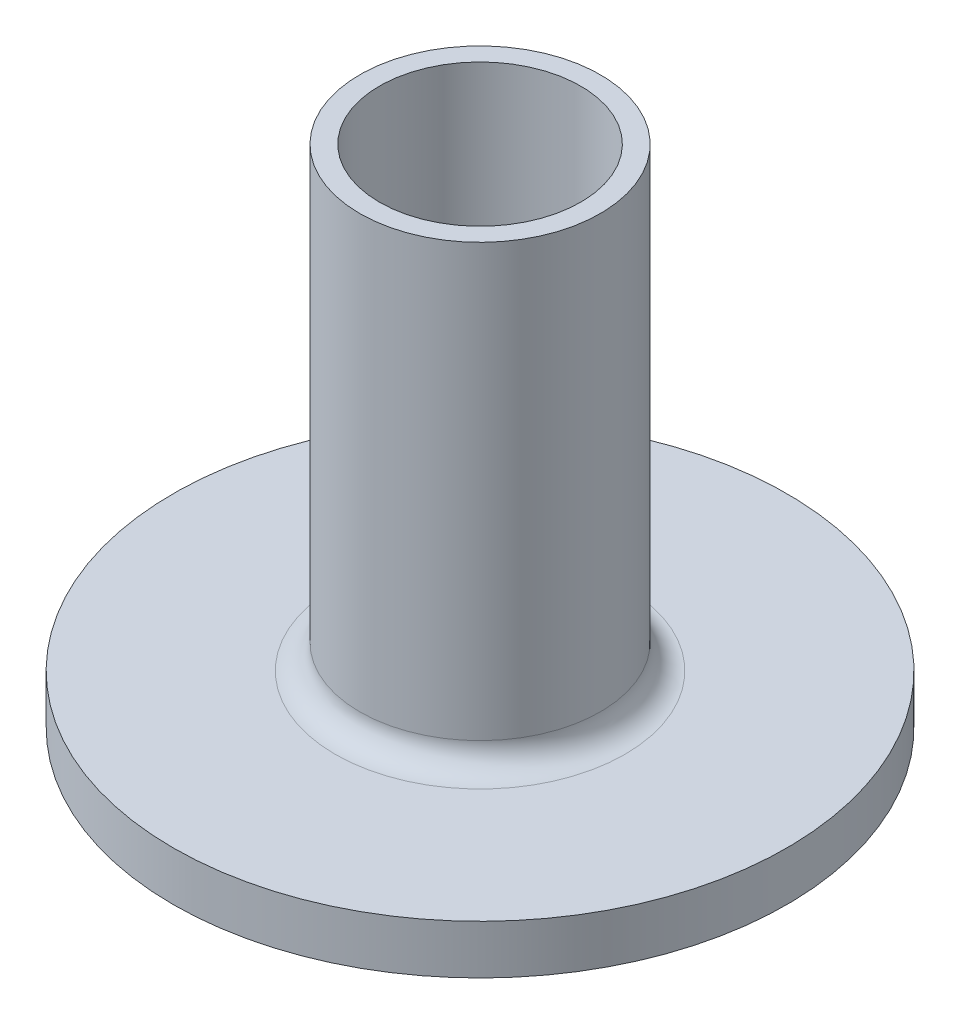
from build123d import *

# Parameters (mm, degrees)
CROQUIS1_R              = 6.25
SALIENTE_EXTRUIR1_DEPTH = 1
CROQUIS2_R              = 2.45
SALIENTE_EXTRUIR2_DEPTH = 9.29
CROQUIS3_R              = 2.05
CORTAR_EXTRUIR1_DEPTH   = 14.564995393
REDONDEO1_R             = 0.5


with BuildPart() as part:
    # Croquis1 → Saliente-Extruir1 (new body)
    with BuildSketch(Plane(origin=(0, 0, 0), x_dir=(1, 0, 0), z_dir=(0, 1, 0))):
        with Locations(Location((0, 0, 0), (0, 0, 270))):
            Circle(CROQUIS1_R)
    extrude(amount=SALIENTE_EXTRUIR1_DEPTH)

    # Croquis2 → Saliente-Extruir2 (add)
    with BuildSketch(Plane(origin=(0, 1, 0), x_dir=(1, 0, 0), z_dir=(0, 1, 0))):
        with Locations(Location((0, 0, 0), (0, 0, 270))):
            Circle(CROQUIS2_R)
    extrude(amount=SALIENTE_EXTRUIR2_DEPTH)

    # Croquis3 → Cortar-Extruir1 (cut, through all)
    with BuildSketch(Plane(origin=(0, 10.29, 0), x_dir=(1, 0, 0), z_dir=(0, 1, 0))):
        with Locations(Location((0, 0, 0), (0, 0, 270))):
            Circle(CROQUIS3_R)
    extrude(amount=-CORTAR_EXTRUIR1_DEPTH, mode=Mode.SUBTRACT)

    # Redondeo1
    redondeo1_edges = [part.edges().sort_by_distance(p)[0] for p in [
        (0, 1, -2.45),
    ]]
    fillet(redondeo1_edges, radius=REDONDEO1_R)


solid = part.part
